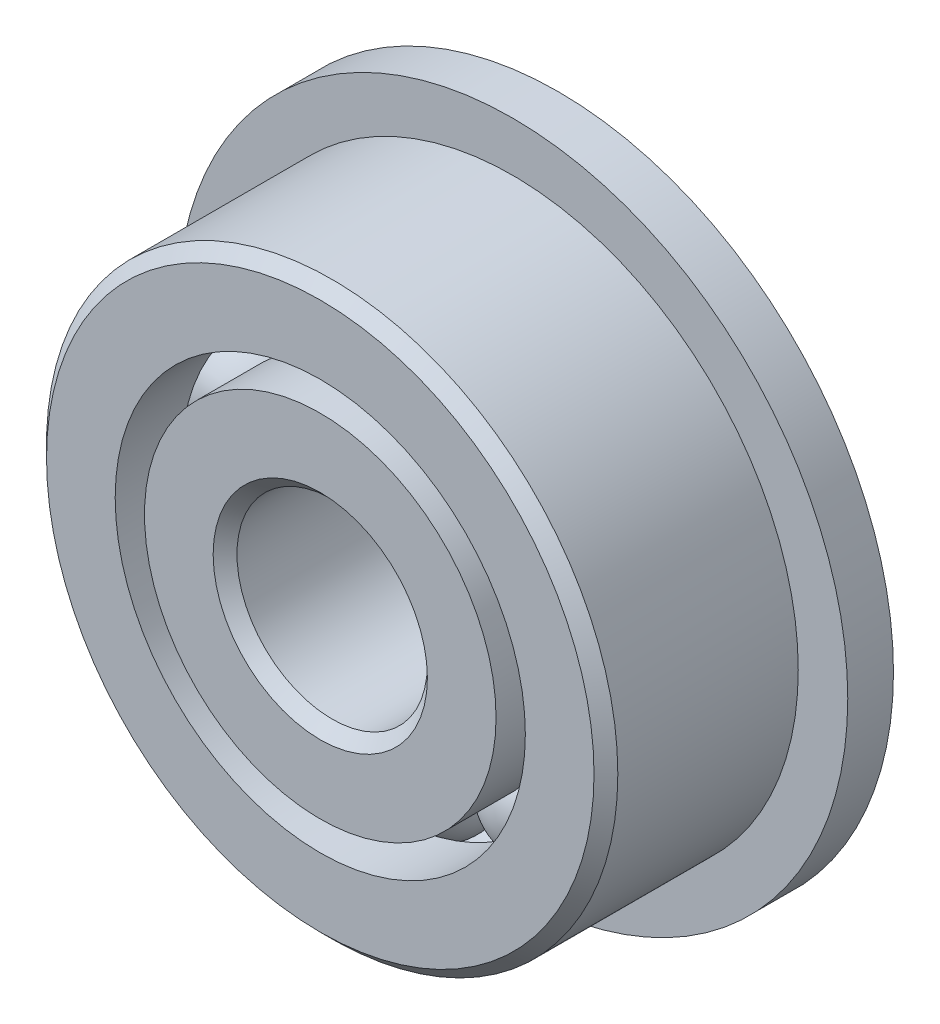
from build123d import *

# Parameters (mm, degrees)
CIRPATTERN1_COUNT = 10
SKETCH6_W         = 0.762
SKETCH6_H         = 2.168769231


with BuildPart() as part:
    # Sketch1 → Revolve1 (revolve)
    with BuildSketch(Plane(origin=(0, 0, 0), x_dir=(0, 0, -1), z_dir=(1, 0, 0)), mode=Mode.PRIVATE) as revolve1_sk:
        with BuildLine():
            Line((1.7859375, 4.7625), (-1.7859375, 4.7625))
            Line((-1.7859375, 4.7625), (-1.984375, 4.5640625))
            Line((-1.984375, 4.5640625), (-1.984375, 3.419230769))
            Line((-1.984375, 3.419230769), (-0.881944444, 3.419230769))
            ThreePointArc((-0.881944444, 3.419230769), (0, 4.090136422), (0.881944444, 3.419230769))
            Line((0.881944444, 3.419230769), (1.984375, 3.419230769))
            Line((1.984375, 3.419230769), (1.984375, 4.5640625))
            Line((1.984375, 4.5640625), (1.7859375, 4.7625))
        make_face()
    revolve(revolve1_sk.sketch.rotate(Axis((0, 0, 1.984375), (0, 0, -1)), 90), axis=Axis((0, 0, 1.984375), (0, 0, -1)))

    # Sketch6 → Revolve6 (revolve)
    with BuildSketch(Plane(origin=(0, 0, 0), x_dir=(0, 0, -1), z_dir=(1, 0, 0)), mode=Mode.PRIVATE) as revolve6_sk:
        with Locations((1.603375, 4.503615384)):
            Rectangle(SKETCH6_W, SKETCH6_H)
    revolve(revolve6_sk.sketch.rotate(Axis((0, 0, -1.984375), (0, 0, 1)), 270), axis=Axis((0, 0, -1.984375), (0, 0, 1)))


with BuildPart() as body_2:
    # Sketch3 → Revolve3 (revolve)
    with BuildSketch(Plane(origin=(0, 0, 0), x_dir=(0, 0, -1), z_dir=(1, 0, 0)), mode=Mode.PRIVATE) as revolve3_sk:
        with BuildLine():
            Line((-1.984375, 2.930769231), (-0.881944444, 2.930769231))
            ThreePointArc((-0.881944444, 2.930769231), (0, 2.259863578), (0.881944444, 2.930769231))
            Line((0.881944444, 2.930769231), (1.984375, 2.930769231))
            Line((1.984375, 2.930769231), (1.984375, 1.7859375))
            Line((1.984375, 1.7859375), (1.7859375, 1.5875))
            Line((1.7859375, 1.5875), (-1.7859375, 1.5875))
            Line((-1.7859375, 1.5875), (-1.984375, 1.7859375))
            Line((-1.984375, 1.7859375), (-1.984375, 2.930769231))
        make_face()
    revolve(revolve3_sk.sketch.rotate(Axis((0, 0, 1.984375), (0, 0, -1)), 90), axis=Axis((0, 0, 1.984375), (0, 0, -1)))


with BuildPart() as body_3:
    # Sketch4 → Revolve4 (revolve)
    with BuildSketch(Plane(origin=(0, 0, 0), x_dir=(0, 0, -1), z_dir=(1, 0, 0))):
        with BuildLine():
            Line((-0.915136422, 3.175), (0.915136422, 3.175))
            ThreePointArc((0.915136422, 3.175), (0, 4.090136422), (-0.915136422, 3.175))
        make_face()
    revolve(axis=Axis((0, 3.175, 0.915136422), (0, 0, -1)))


with BuildPart() as cirpattern1_1:
    # CirPattern1: pattern copy
    add(body_3.part.rotate(Axis((0, 0, 0), (0, 0, 1)), 1 * 360 / CIRPATTERN1_COUNT))


with BuildPart() as cirpattern1_2:
    # CirPattern1: pattern copy
    add(body_3.part.rotate(Axis((0, 0, 0), (0, 0, 1)), 2 * 360 / CIRPATTERN1_COUNT))


with BuildPart() as cirpattern1_3:
    # CirPattern1: pattern copy
    add(body_3.part.rotate(Axis((0, 0, 0), (0, 0, 1)), 3 * 360 / CIRPATTERN1_COUNT))


with BuildPart() as cirpattern1_4:
    # CirPattern1: pattern copy
    add(body_3.part.rotate(Axis((0, 0, 0), (0, 0, 1)), 4 * 360 / CIRPATTERN1_COUNT))


with BuildPart() as cirpattern1_5:
    # CirPattern1: pattern copy
    add(body_3.part.rotate(Axis((0, 0, 0), (0, 0, 1)), 5 * 360 / CIRPATTERN1_COUNT))


with BuildPart() as cirpattern1_6:
    # CirPattern1: pattern copy
    add(body_3.part.rotate(Axis((0, 0, 0), (0, 0, 1)), 6 * 360 / CIRPATTERN1_COUNT))


with BuildPart() as cirpattern1_7:
    # CirPattern1: pattern copy
    add(body_3.part.rotate(Axis((0, 0, 0), (0, 0, 1)), 7 * 360 / CIRPATTERN1_COUNT))


with BuildPart() as cirpattern1_8:
    # CirPattern1: pattern copy
    add(body_3.part.rotate(Axis((0, 0, 0), (0, 0, 1)), 8 * 360 / CIRPATTERN1_COUNT))


with BuildPart() as cirpattern1_9:
    # CirPattern1: pattern copy
    add(body_3.part.rotate(Axis((0, 0, 0), (0, 0, 1)), 9 * 360 / CIRPATTERN1_COUNT))


solid = Compound([part.part, body_2.part, body_3.part, cirpattern1_1.part, cirpattern1_2.part, cirpattern1_3.part, cirpattern1_4.part, cirpattern1_5.part, cirpattern1_6.part, cirpattern1_7.part, cirpattern1_8.part, cirpattern1_9.part])
